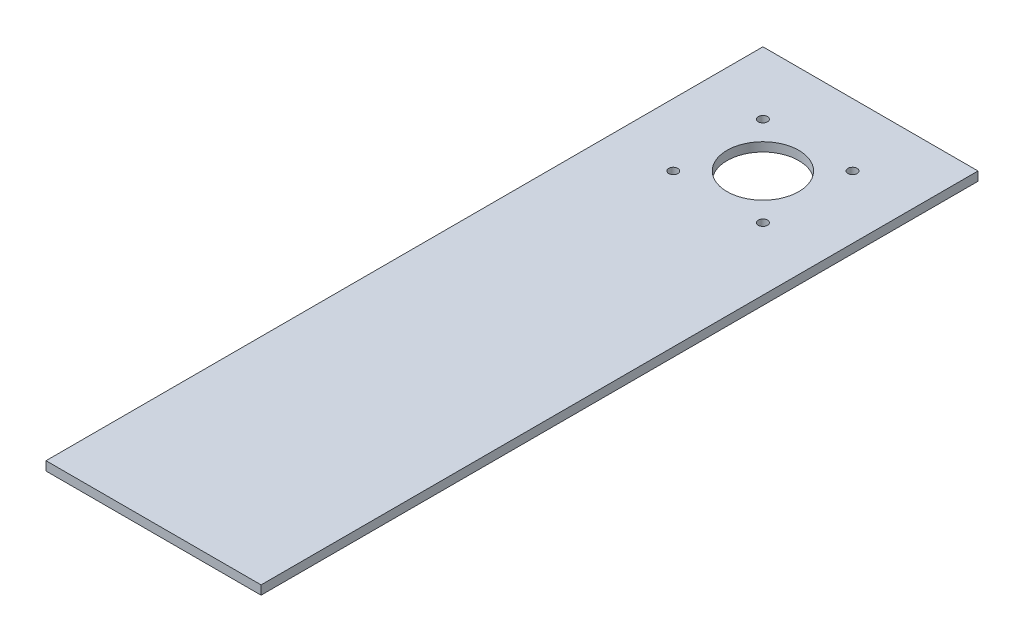
from build123d import *

# Parameters (mm, degrees)
SKETCH1_W           = 120
SKETCH1_H           = 120
SKETCH1_R           = 2.55
SKETCH1_R_2         = 20
BOSS_EXTRUDE1_DEPTH = 5
SKETCH2_W           = 120
SKETCH2_H           = 5
BOSS_EXTRUDE2_DEPTH = 280


with BuildPart() as part:
    # Sketch1 → Boss-Extrude1 (new body)
    with BuildSketch(Plane(origin=(0, 0, 0), x_dir=(1, 0, 0), z_dir=(0, 1, 0))):
        Rectangle(SKETCH1_W, SKETCH1_H)
        with Locations(Location((-25.000001015, -25.000001015, 0), (0, 0, 270))):
            Circle(SKETCH1_R, mode=Mode.SUBTRACT)
        with Locations(Location((24.999998985, -24.999998985, 0), (0, 0, 270))):
            Circle(SKETCH1_R, mode=Mode.SUBTRACT)
        with Locations(Location((25.000001015, 25.000001015, 0), (0, 0, 270))):
            Circle(SKETCH1_R, mode=Mode.SUBTRACT)
        with Locations(Location((-24.999998985, 24.999998985, 0), (0, 0, 270))):
            Circle(SKETCH1_R, mode=Mode.SUBTRACT)
        with Locations(Location((0, 0, 0), (0, 0, 270))):
            Circle(SKETCH1_R_2, mode=Mode.SUBTRACT)
    extrude(amount=BOSS_EXTRUDE1_DEPTH)

    # Sketch2 → Boss-Extrude2 (add)
    with BuildSketch(Plane.XY.offset(60)):
        with Locations((0, 2.5)):
            Rectangle(SKETCH2_W, SKETCH2_H)
    extrude(amount=BOSS_EXTRUDE2_DEPTH)


solid = part.part
